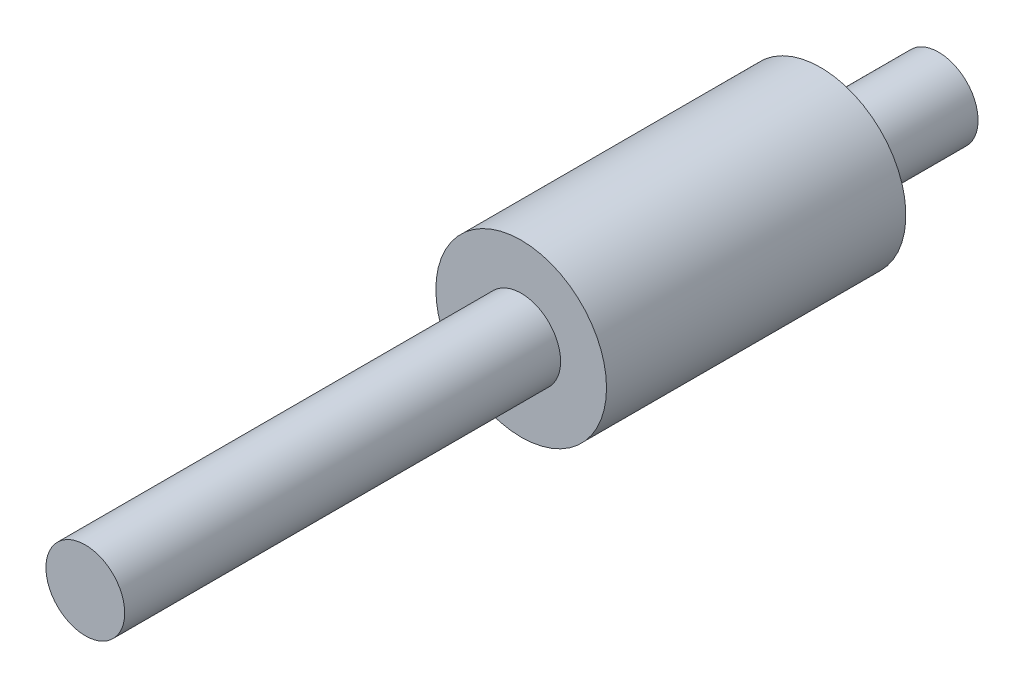
from build123d import *

# Parameters (mm, degrees)
SKETCH1_R           = 6.5
BOSS_EXTRUDE1_DEPTH = 65
CUT_EXTRUDE2_START  = -33.2
SKETCH3_R           = 6.5
SKETCH3_R_2         = 3
CUT_EXTRUDE2_DEPTH  = 33.2
SKETCH4_R           = 6.5
SKETCH4_R_2         = 3
CUT_EXTRUDE3_DEPTH  = 9


with BuildPart() as part:
    # Sketch1 → Boss-Extrude1 (new body)
    with BuildSketch(Plane.XY):
        Circle(SKETCH1_R)
    extrude(amount=BOSS_EXTRUDE1_DEPTH)

    # Sketch3 → Cut-Extrude2 (cut)
    with BuildSketch(Plane.XY.offset(65).offset(CUT_EXTRUDE2_START)):
        Circle(SKETCH3_R)
        Circle(SKETCH3_R_2, mode=Mode.SUBTRACT)
    extrude(amount=CUT_EXTRUDE2_DEPTH, mode=Mode.SUBTRACT)

    # Sketch4 → Cut-Extrude3 (cut)
    with BuildSketch(Plane(origin=(0, 0, 0), x_dir=(-1, 0, 0), z_dir=(0, 0, -1))):
        Circle(SKETCH4_R)
        with Locations(Location((0, 0, 0), (0, 0, 180))):
            Circle(SKETCH4_R_2, mode=Mode.SUBTRACT)
    extrude(amount=-CUT_EXTRUDE3_DEPTH, mode=Mode.SUBTRACT)


solid = part.part
